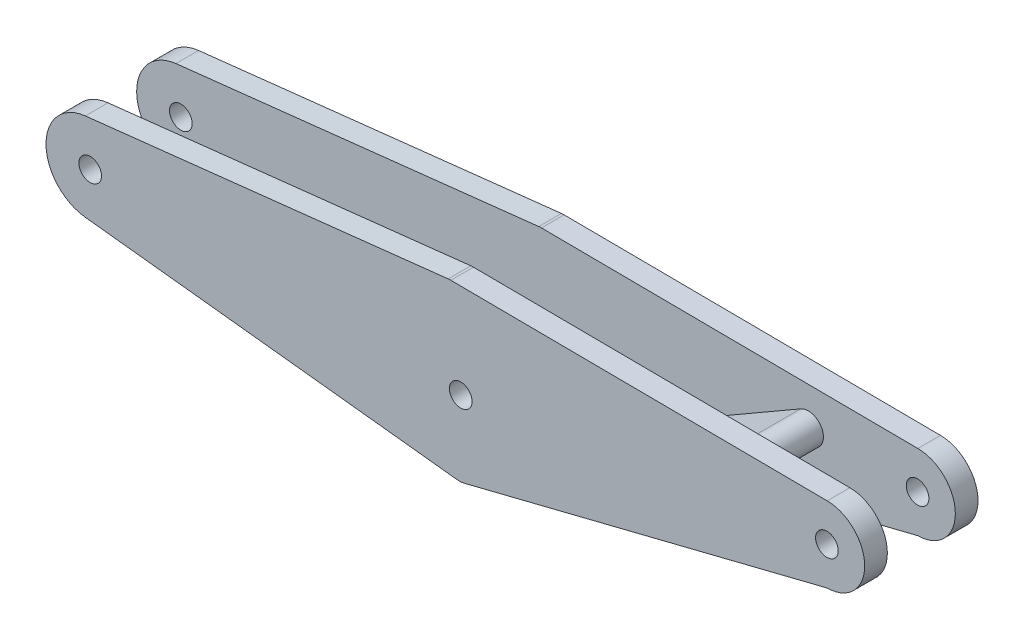
from build123d import *

# Parameters (mm, degrees)
SKETCH1_R               = 3.81
BOSS_EXTRUDE1_DEPTH     = 38.1
CUT_EXTRUDE1_DEPTH      = 170.081733479
CUT_EXTRUDE1_DEPTH_BACK = 170.081733479
SKETCH2_W               = 296.702154824
SKETCH2_H               = 22.86
BOSS_EXTRUDE2_DEPTH     = 22.86
SCALE1_SCALE            = 2


with BuildPart() as part:
    # Sketch1 → Boss-Extrude1 (new body)
    with BuildSketch(Plane.XY):
        with BuildLine():
            Line((-147.344668758, 6.620564835), (-25.355087155, 20.167363089))
            ThreePointArc((-25.355087155, 20.167363089), (-24.906608979, 20.2037996), (-24.456762072, 20.213701798))
            Line((-24.456762072, 20.213701798), (102.089114394, 19.262041389))
            ThreePointArc((102.089114394, 19.262041389), (114.69360954, 6.562400496), (102.089114394, -6.137240398))
            Line((102.089114394, -6.137240398), (-19.792437318, -36.600949276))
            ThreePointArc((-19.792437318, -36.600949276), (-21.128759573, -36.811186783), (-22.481199669, -36.781813943))
            Line((-22.481199669, -36.781813943), (-147.344668758, -22.915873894))
            ThreePointArc((-147.344668758, -22.915873894), (-160.563675525, -8.14765453), (-147.344668758, 6.620564835))
        make_face()
        with Locations((-145.704675525, -8.14765453)):
            Circle(SKETCH1_R, mode=Mode.SUBTRACT)
        with Locations((101.99360954, 6.562400496)):
            Circle(SKETCH1_R, mode=Mode.SUBTRACT)
        with Locations((-21.120571626, -11.532910072)):
            Circle(SKETCH1_R, mode=Mode.SUBTRACT)
    extrude(amount=-BOSS_EXTRUDE1_DEPTH)

    # Sketch2 → Cut-Extrude1 (cut, two sides: drawn at the far end of the back side and taken through both)
    with BuildSketch(Plane(origin=(0, 0, 0), x_dir=(1, 0, 0), z_dir=(0, 1, 0)).offset(-CUT_EXTRUDE1_DEPTH_BACK)):
        with Locations((-25.145403948, 19.05)):
            Rectangle(SKETCH2_W, SKETCH2_H)
    extrude(amount=CUT_EXTRUDE1_DEPTH + CUT_EXTRUDE1_DEPTH_BACK, mode=Mode.SUBTRACT)


with BuildPart() as cut_extrude1_piece_1:
    # of the separate pieces the step leaves, piece 1, a body of its own (cut_extrude1_pieces)
    add(part.part.solids().sort_by_distance((-25.355087155, 20.167363089, -30.48))[0])



with BuildPart() as cut_extrude1_piece_2:
    # of the separate pieces the step leaves, piece 2, a body of its own (cut_extrude1_pieces)
    add(part.part.solids().sort_by_distance((-147.344668758, 6.620564835, 0))[0])


with BuildPart() as cut_extrude1_piece_1_1:
    add(cut_extrude1_piece_1.part)

    add(cut_extrude1_piece_2.part)  # Boss-Extrude2 merges Cut-Extrude1 piece 2
    # Sketch6 → Boss-Extrude2 (add)
    with BuildSketch(Plane.XY.offset(-30.48)):
        with BuildLine():
            Line((67.799114394, 2.317128757), (37.003251036, -15.462871243))
            ThreePointArc((37.003251036, -15.462871243), (30.063841985, -13.603462192), (31.923251036, -6.664053141))
            Line((31.923251036, -6.664053141), (62.719114394, 11.115946859))
            ThreePointArc((62.719114394, 11.115946859), (69.658523446, 9.256537808), (67.799114394, 2.317128757))
        make_face()
    extrude(amount=BOSS_EXTRUDE2_DEPTH)


with BuildPart() as cut_extrude1_piece_1_2:
    # Scale1: scaled about (-20.825252389, -4.795459228, -19.05)
    add(cut_extrude1_piece_1_1.part.scale(SCALE1_SCALE).moved(Location((20.825252389, 4.795459228, 19.05))))


solid = cut_extrude1_piece_1_2.part
